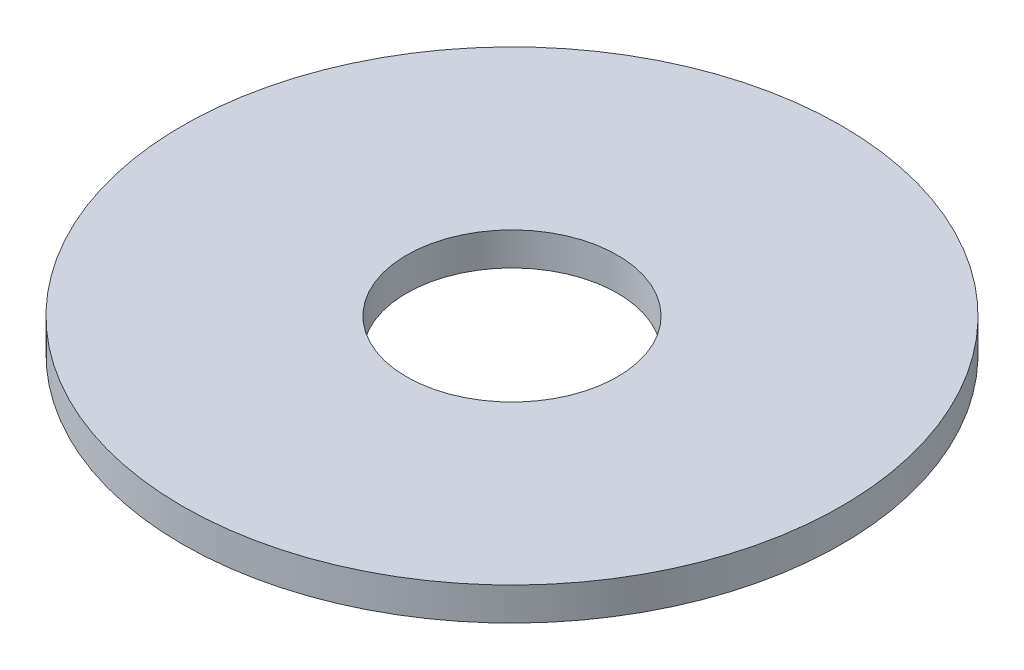
from build123d import *

# Parameters (mm, degrees)
SKIZZE1_R                       = 5
SKIZZE1_R_2                     = 1.6
AUFSATZ_LINEAR_AUSTRAGEN1_DEPTH = 0.5


with BuildPart() as part:
    # Skizze1 → Aufsatz-Linear austragen1 (new body)
    with BuildSketch(Plane(origin=(0, 0, 0), x_dir=(1, 0, 0), z_dir=(0, 1, 0))):
        with Locations(Location((0, 0, 0), (0, 0, 270))):
            Circle(SKIZZE1_R)
        with Locations(Location((0, 0, 0), (0, 0, 270))):
            Circle(SKIZZE1_R_2, mode=Mode.SUBTRACT)
    extrude(amount=AUFSATZ_LINEAR_AUSTRAGEN1_DEPTH)


solid = part.part
